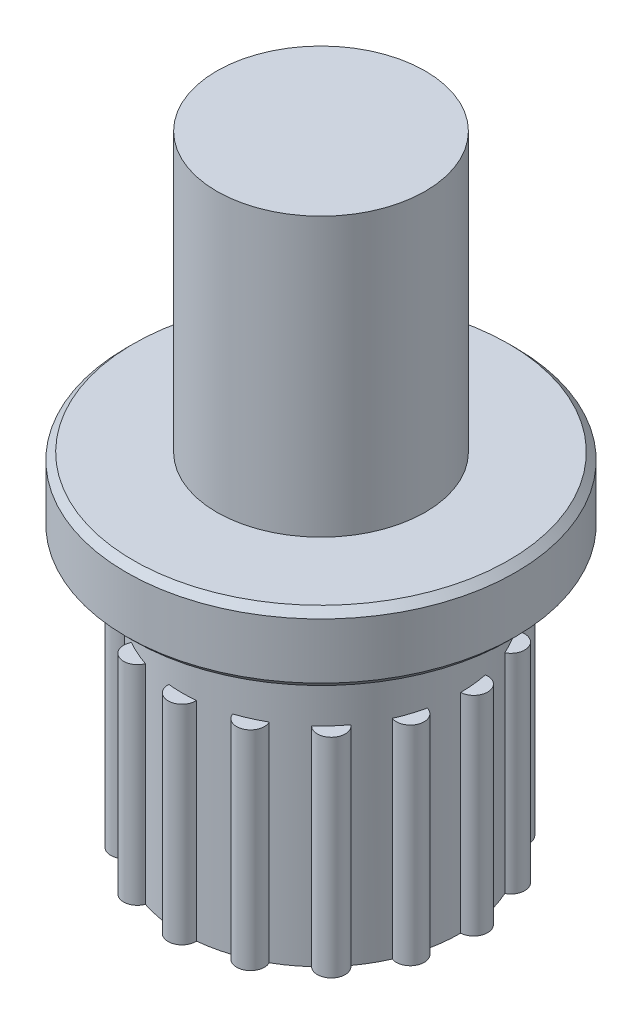
from build123d import *

# Parameters (mm, degrees)
SKETCH3_R           = 1
BOSS_EXTRUDE1_DEPTH = 15
CIRPATTERN1_COUNT   = 15
CHAMFER1_SIZE       = 0.5


with BuildPart() as part:
    # Sketch2 → Revolve1 (revolve)
    with BuildSketch(Plane(origin=(0, 0, 0), x_dir=(0, 0, -1), z_dir=(1, 0, 0)), mode=Mode.PRIVATE) as revolve1_sk:
        Polygon((0, 0), (10, 0), (10, 20), (14, 20), (14, 25), (7.5, 25), (7.5, 45), (0, 45), align=None)
    revolve(revolve1_sk.sketch.rotate(Axis((0, 45, 0), (0, -1, 0)), 180), axis=Axis((0, 45, 0), (0, -1, 0)))

    # Sketch3 → Boss-Extrude1 (add)
    with BuildSketch(Plane.XZ):
        with Locations((0, 10)):
            Circle(SKETCH3_R)
    boss_extrude1 = extrude(amount=-BOSS_EXTRUDE1_DEPTH)

    # CirPattern1: Boss-Extrude1 ×15 about axis
    cirpattern1_axis = Axis((0, 0, 0), (0, 1, 0))
    for i in range(1, CIRPATTERN1_COUNT):
        add(boss_extrude1.rotate(cirpattern1_axis, i * 360 / CIRPATTERN1_COUNT))

    # Chamfer1
    chamfer1_edges = [part.edges().sort_by_distance(p)[0] for p in [
        (0, 25, -14),
        (0, 20, -14),
    ]]
    chamfer(chamfer1_edges, length=CHAMFER1_SIZE)


solid = part.part
